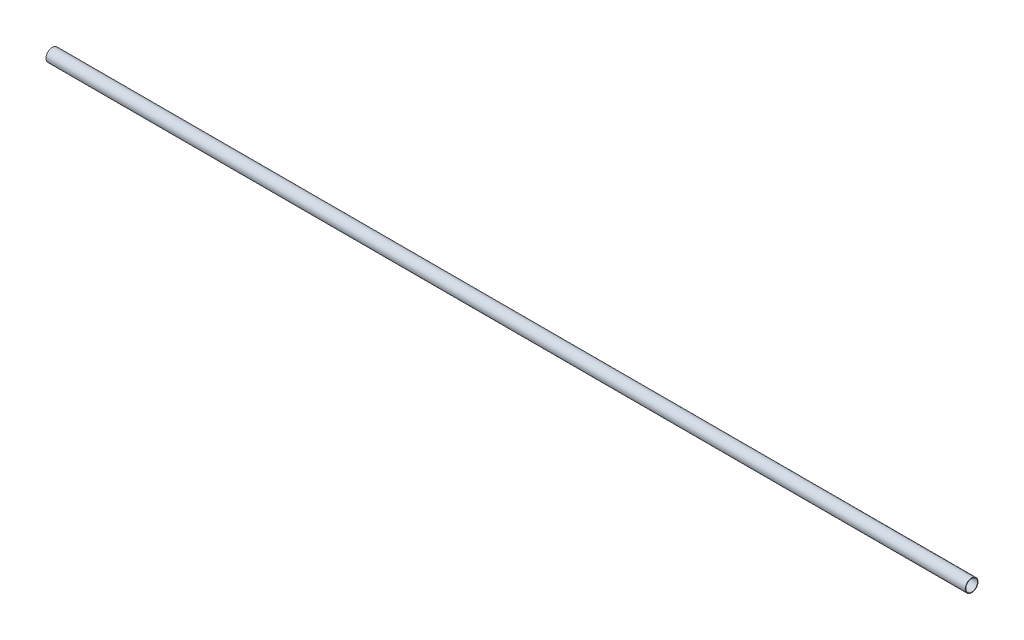
from build123d import *

# Parameters (mm, degrees)
SKETCH1_R      = 6.35
SKETCH1_R_2    = 5.842
EXTRUDE1_DEPTH = 457.2


with BuildPart() as part:
    # Sketch1 → Extrude1 (new, symmetric)
    with BuildSketch(Plane(origin=(0, 0, 0), x_dir=(0, 0, -1), z_dir=(1, 0, 0))):
        Circle(SKETCH1_R)
        Circle(SKETCH1_R_2, mode=Mode.SUBTRACT)
    extrude(amount=EXTRUDE1_DEPTH, both=True)


solid = part.part
